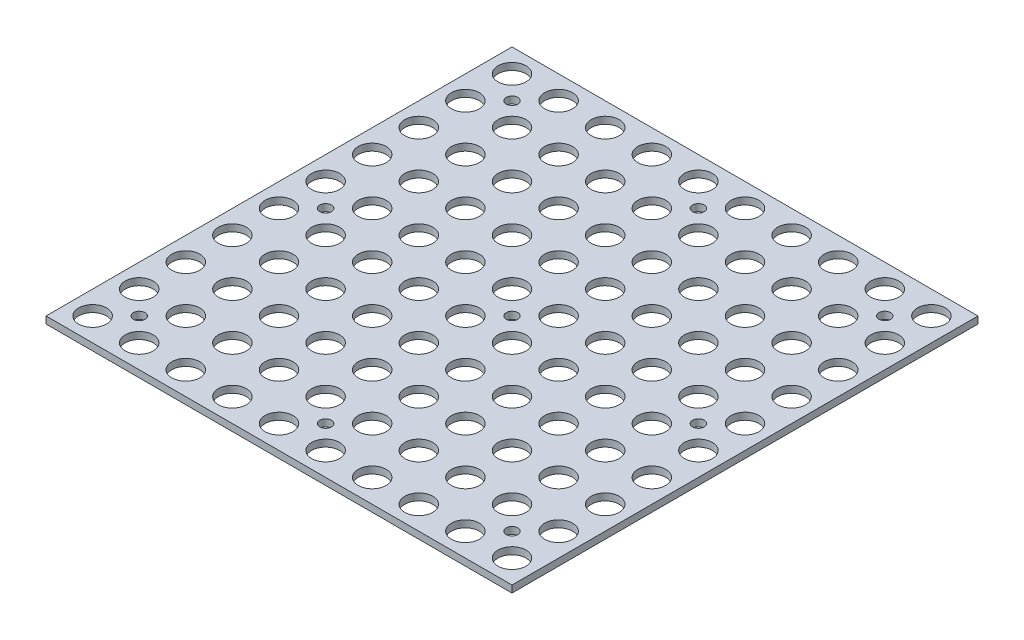
from build123d import *

# Parameters (mm, degrees)
SKETCH3_W            = 200
SKETCH3_H            = 200
BOSS_EXTRUDE2_DEPTH  = 3
SKETCH1_R            = 6
CUT_EXTRUDE1_DEPTH   = 142.453172464
SKETCH4_R            = 2.5
CUT_EXTRUDE2_DEPTH   = 142.453172464
LPATTERN1_COUNT      = 3
LPATTERN1_PITCH      = 80
LPATTERN1_COUNT_DIR2 = 3
LPATTERN1_PITCH_DIR2 = 80


with BuildPart() as part:
    # Sketch3 → Boss-Extrude2 (new body)
    with BuildSketch(Plane(origin=(0, 0, 0), x_dir=(1, 0, 0), z_dir=(0, 1, 0))):
        Rectangle(SKETCH3_W, SKETCH3_H)
    extrude(amount=BOSS_EXTRUDE2_DEPTH)

    # Sketch1 → Cut-Extrude1 (cut, through all)
    with BuildSketch(Plane(origin=(0, 0, 0), x_dir=(1, 0, 0), z_dir=(0, 1, 0))):
        with Locations(Location((-90, -90, 0), (0, 0, 270))):
            Circle(SKETCH1_R)
        with Locations(Location((-70, -90, 0), (0, 0, 270))):
            Circle(SKETCH1_R)
        with Locations(Location((-50, -90, 0), (0, 0, 270))):
            Circle(SKETCH1_R)
        with Locations(Location((-30, -90, 0), (0, 0, 270))):
            Circle(SKETCH1_R)
        with Locations(Location((-10, -90, 0), (0, 0, 270))):
            Circle(SKETCH1_R)
        with Locations(Location((10, -90, 0), (0, 0, 270))):
            Circle(SKETCH1_R)
        with Locations(Location((30, -90, 0), (0, 0, 270))):
            Circle(SKETCH1_R)
        with Locations(Location((50, -90, 0), (0, 0, 270))):
            Circle(SKETCH1_R)
        with Locations(Location((70, -90, 0), (0, 0, 270))):
            Circle(SKETCH1_R)
        with Locations(Location((90, -90, 0), (0, 0, 270))):
            Circle(SKETCH1_R)
        with Locations(Location((-70, -70, 0), (0, 0, 270))):
            Circle(SKETCH1_R)
        with Locations(Location((-50, -70, 0), (0, 0, 270))):
            Circle(SKETCH1_R)
        with Locations(Location((-30, -70, 0), (0, 0, 270))):
            Circle(SKETCH1_R)
        with Locations(Location((-10, -70, 0), (0, 0, 270))):
            Circle(SKETCH1_R)
        with Locations(Location((10, -70, 0), (0, 0, 270))):
            Circle(SKETCH1_R)
        with Locations(Location((30, -70, 0), (0, 0, 270))):
            Circle(SKETCH1_R)
        with Locations(Location((50, -70, 0), (0, 0, 270))):
            Circle(SKETCH1_R)
        with Locations(Location((70, -70, 0), (0, 0, 270))):
            Circle(SKETCH1_R)
        with Locations(Location((90, -70, 0), (0, 0, 270))):
            Circle(SKETCH1_R)
        with Locations(Location((-70, -50, 0), (0, 0, 270))):
            Circle(SKETCH1_R)
        with Locations(Location((-50, -50, 0), (0, 0, 270))):
            Circle(SKETCH1_R)
        with Locations(Location((-30, -50, 0), (0, 0, 270))):
            Circle(SKETCH1_R)
        with Locations(Location((-10, -50, 0), (0, 0, 270))):
            Circle(SKETCH1_R)
        with Locations(Location((10, -50, 0), (0, 0, 270))):
            Circle(SKETCH1_R)
        with Locations(Location((30, -50, 0), (0, 0, 270))):
            Circle(SKETCH1_R)
        with Locations(Location((50, -50, 0), (0, 0, 270))):
            Circle(SKETCH1_R)
        with Locations(Location((70, -50, 0), (0, 0, 270))):
            Circle(SKETCH1_R)
        with Locations(Location((90, -50, 0), (0, 0, 270))):
            Circle(SKETCH1_R)
        with Locations(Location((-70, -30, 0), (0, 0, 270))):
            Circle(SKETCH1_R)
        with Locations(Location((-50, -30, 0), (0, 0, 270))):
            Circle(SKETCH1_R)
        with Locations(Location((-30, -30, 0), (0, 0, 270))):
            Circle(SKETCH1_R)
        with Locations(Location((-10, -30, 0), (0, 0, 270))):
            Circle(SKETCH1_R)
        with Locations(Location((10, -30, 0), (0, 0, 270))):
            Circle(SKETCH1_R)
        with Locations(Location((30, -30, 0), (0, 0, 270))):
            Circle(SKETCH1_R)
        with Locations(Location((50, -30, 0), (0, 0, 270))):
            Circle(SKETCH1_R)
        with Locations(Location((70, -30, 0), (0, 0, 270))):
            Circle(SKETCH1_R)
        with Locations(Location((90, -30, 0), (0, 0, 270))):
            Circle(SKETCH1_R)
        with Locations(Location((-70, -10, 0), (0, 0, 270))):
            Circle(SKETCH1_R)
        with Locations(Location((-50, -10, 0), (0, 0, 270))):
            Circle(SKETCH1_R)
        with Locations(Location((-30, -10, 0), (0, 0, 270))):
            Circle(SKETCH1_R)
        with Locations(Location((-10, -10, 0), (0, 0, 270))):
            Circle(SKETCH1_R)
        with Locations(Location((10, -10, 0), (0, 0, 270))):
            Circle(SKETCH1_R)
        with Locations(Location((30, -10, 0), (0, 0, 270))):
            Circle(SKETCH1_R)
        with Locations(Location((50, -10, 0), (0, 0, 270))):
            Circle(SKETCH1_R)
        with Locations(Location((70, -10, 0), (0, 0, 270))):
            Circle(SKETCH1_R)
        with Locations(Location((90, -10, 0), (0, 0, 270))):
            Circle(SKETCH1_R)
        with Locations(Location((-70, 10, 0), (0, 0, 270))):
            Circle(SKETCH1_R)
        with Locations(Location((-50, 10, 0), (0, 0, 270))):
            Circle(SKETCH1_R)
        with Locations(Location((-30, 10, 0), (0, 0, 270))):
            Circle(SKETCH1_R)
        with Locations(Location((-10, 10, 0), (0, 0, 270))):
            Circle(SKETCH1_R)
        with Locations(Location((10, 10, 0), (0, 0, 270))):
            Circle(SKETCH1_R)
        with Locations(Location((30, 10, 0), (0, 0, 270))):
            Circle(SKETCH1_R)
        with Locations(Location((50, 10, 0), (0, 0, 270))):
            Circle(SKETCH1_R)
        with Locations(Location((70, 10, 0), (0, 0, 270))):
            Circle(SKETCH1_R)
        with Locations(Location((90, 10, 0), (0, 0, 270))):
            Circle(SKETCH1_R)
        with Locations(Location((-70, 30, 0), (0, 0, 270))):
            Circle(SKETCH1_R)
        with Locations(Location((-50, 30, 0), (0, 0, 270))):
            Circle(SKETCH1_R)
        with Locations(Location((-30, 30, 0), (0, 0, 270))):
            Circle(SKETCH1_R)
        with Locations(Location((-10, 30, 0), (0, 0, 270))):
            Circle(SKETCH1_R)
        with Locations(Location((10, 30, 0), (0, 0, 270))):
            Circle(SKETCH1_R)
        with Locations(Location((30, 30, 0), (0, 0, 270))):
            Circle(SKETCH1_R)
        with Locations(Location((50, 30, 0), (0, 0, 270))):
            Circle(SKETCH1_R)
        with Locations(Location((70, 30, 0), (0, 0, 270))):
            Circle(SKETCH1_R)
        with Locations(Location((90, 30, 0), (0, 0, 270))):
            Circle(SKETCH1_R)
        with Locations(Location((-70, 50, 0), (0, 0, 270))):
            Circle(SKETCH1_R)
        with Locations(Location((-50, 50, 0), (0, 0, 270))):
            Circle(SKETCH1_R)
        with Locations(Location((-30, 50, 0), (0, 0, 270))):
            Circle(SKETCH1_R)
        with Locations(Location((-10, 50, 0), (0, 0, 270))):
            Circle(SKETCH1_R)
        with Locations(Location((10, 50, 0), (0, 0, 270))):
            Circle(SKETCH1_R)
        with Locations(Location((30, 50, 0), (0, 0, 270))):
            Circle(SKETCH1_R)
        with Locations(Location((50, 50, 0), (0, 0, 270))):
            Circle(SKETCH1_R)
        with Locations(Location((70, 50, 0), (0, 0, 270))):
            Circle(SKETCH1_R)
        with Locations(Location((90, 50, 0), (0, 0, 270))):
            Circle(SKETCH1_R)
        with Locations(Location((-70, 70, 0), (0, 0, 270))):
            Circle(SKETCH1_R)
        with Locations(Location((-50, 70, 0), (0, 0, 270))):
            Circle(SKETCH1_R)
        with Locations(Location((-30, 70, 0), (0, 0, 270))):
            Circle(SKETCH1_R)
        with Locations(Location((-10, 70, 0), (0, 0, 270))):
            Circle(SKETCH1_R)
        with Locations(Location((10, 70, 0), (0, 0, 270))):
            Circle(SKETCH1_R)
        with Locations(Location((30, 70, 0), (0, 0, 270))):
            Circle(SKETCH1_R)
        with Locations(Location((50, 70, 0), (0, 0, 270))):
            Circle(SKETCH1_R)
        with Locations(Location((70, 70, 0), (0, 0, 270))):
            Circle(SKETCH1_R)
        with Locations(Location((90, 70, 0), (0, 0, 270))):
            Circle(SKETCH1_R)
        with Locations(Location((-70, 90, 0), (0, 0, 270))):
            Circle(SKETCH1_R)
        with Locations(Location((-50, 90, 0), (0, 0, 270))):
            Circle(SKETCH1_R)
        with Locations(Location((-30, 90, 0), (0, 0, 270))):
            Circle(SKETCH1_R)
        with Locations(Location((-10, 90, 0), (0, 0, 270))):
            Circle(SKETCH1_R)
        with Locations(Location((10, 90, 0), (0, 0, 270))):
            Circle(SKETCH1_R)
        with Locations(Location((30, 90, 0), (0, 0, 270))):
            Circle(SKETCH1_R)
        with Locations(Location((50, 90, 0), (0, 0, 270))):
            Circle(SKETCH1_R)
        with Locations(Location((70, 90, 0), (0, 0, 270))):
            Circle(SKETCH1_R)
        with Locations(Location((90, 90, 0), (0, 0, 270))):
            Circle(SKETCH1_R)
        with Locations(Location((-90, -70, 0), (0, 0, 270))):
            Circle(SKETCH1_R)
        with Locations(Location((-90, -50, 0), (0, 0, 270))):
            Circle(SKETCH1_R)
        with Locations(Location((-90, -30, 0), (0, 0, 270))):
            Circle(SKETCH1_R)
        with Locations(Location((-90, -10, 0), (0, 0, 270))):
            Circle(SKETCH1_R)
        with Locations(Location((-90, 10, 0), (0, 0, 270))):
            Circle(SKETCH1_R)
        with Locations(Location((-90, 30, 0), (0, 0, 270))):
            Circle(SKETCH1_R)
        with Locations(Location((-90, 50, 0), (0, 0, 270))):
            Circle(SKETCH1_R)
        with Locations(Location((-90, 70, 0), (0, 0, 270))):
            Circle(SKETCH1_R)
        with Locations(Location((-90, 90, 0), (0, 0, 270))):
            Circle(SKETCH1_R)
    extrude(amount=CUT_EXTRUDE1_DEPTH, mode=Mode.SUBTRACT)

    # Sketch4 → Cut-Extrude2 (cut, through all)
    with BuildSketch(Plane(origin=(0, 3, 0), x_dir=(1, 0, 0), z_dir=(0, 1, 0))):
        with Locations(Location((-80, -80, 0), (0, 0, 270))):
            Circle(SKETCH4_R)
    cut_extrude2 = extrude(amount=-CUT_EXTRUDE2_DEPTH, mode=Mode.SUBTRACT)

    # LPattern1: Cut-Extrude2 3 × 3
    with Locations(*[(i * LPATTERN1_PITCH, 0, -j * LPATTERN1_PITCH_DIR2) for i in range(LPATTERN1_COUNT) for j in range(LPATTERN1_COUNT_DIR2) if (i, j) != (0, 0)]):
        add(cut_extrude2, mode=Mode.SUBTRACT)


solid = part.part
